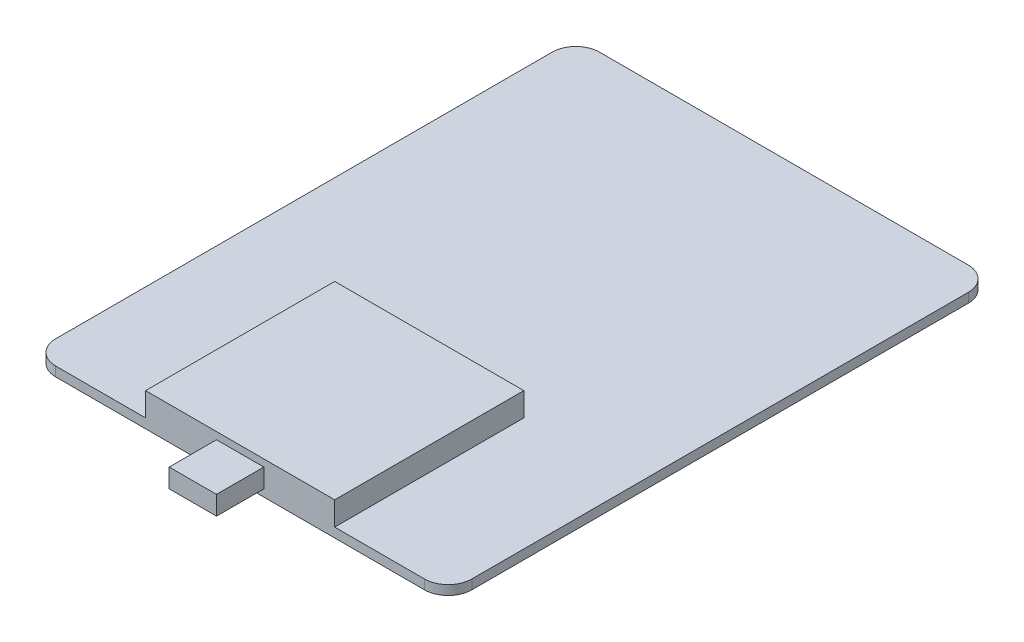
from build123d import *

# Parameters (mm, degrees)
BOSS_EXTRUDE4_DEPTH = 2
SKETCH6_W           = 40
SKETCH6_H           = 40
BOSS_EXTRUDE5_DEPTH = 5
SKETCH7_W           = 10
SKETCH7_H           = 4
BOSS_EXTRUDE6_DEPTH = 10


with BuildPart() as part:
    # Sketch5 → Boss-Extrude4 (new body)
    with BuildSketch(Plane(origin=(0, 0, 0), x_dir=(1, 0, 0), z_dir=(0, 1, 0))):
        with BuildLine():
            Line((39, 57.5), (-39, 57.5))
            ThreePointArc((-39, 57.5), (-42.535533906, 56.035533906), (-44, 52.5))
            Line((-44, 52.5), (-44, -52.5))
            ThreePointArc((-44, -52.5), (-42.535533906, -56.035533906), (-39, -57.5))
            Line((-39, -57.5), (39, -57.5))
            ThreePointArc((39, -57.5), (42.535533906, -56.035533906), (44, -52.5))
            Line((44, -52.5), (44, 52.5))
            ThreePointArc((44, 52.5), (42.535533906, 56.035533906), (39, 57.5))
        make_face()
    extrude(amount=BOSS_EXTRUDE4_DEPTH)

    # Sketch6 → Boss-Extrude5 (add)
    with BuildSketch(Plane(origin=(0, 2, 0), x_dir=(1, 0, 0), z_dir=(0, 1, 0))):
        with Locations((0, -37.5)):
            Rectangle(SKETCH6_W, SKETCH6_H)
    extrude(amount=BOSS_EXTRUDE5_DEPTH)

    # Sketch7 → Boss-Extrude6 (add)
    with BuildSketch(Plane.XY.offset(57.5)):
        with Locations((0, 3.5)):
            Rectangle(SKETCH7_W, SKETCH7_H)
    extrude(amount=BOSS_EXTRUDE6_DEPTH)


solid = part.part
